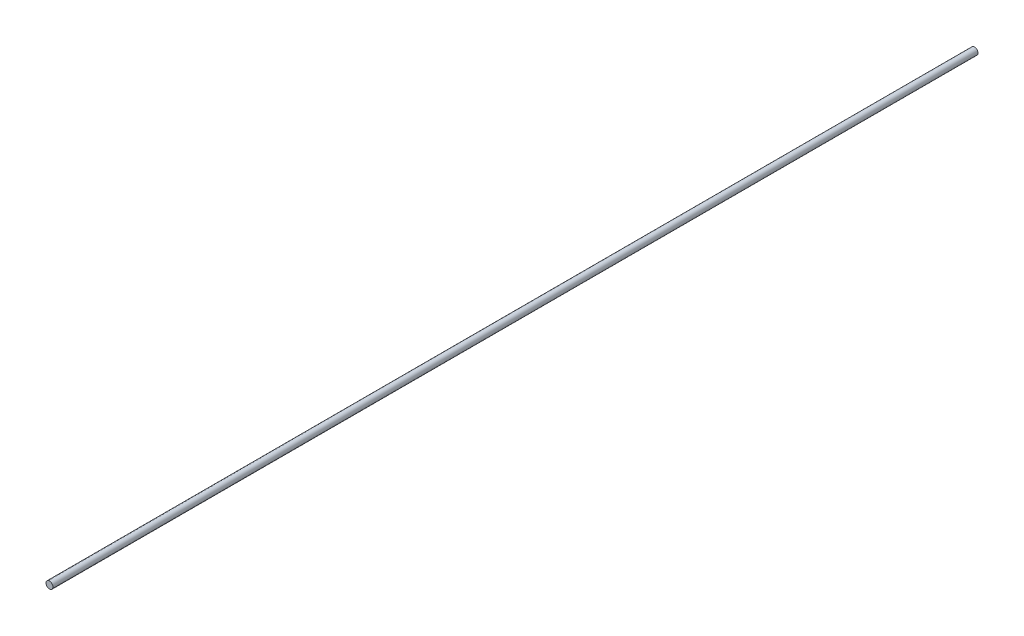
from build123d import *

# Parameters (mm, degrees)
BACKBONESKE_R  = 0.75
BACKBONE_DEPTH = 200


with BuildPart() as part:
    # BackboneSke → Backbone (new body)
    with BuildSketch(Plane.XY):
        Circle(BACKBONESKE_R)
    extrude(amount=BACKBONE_DEPTH)


solid = part.part
